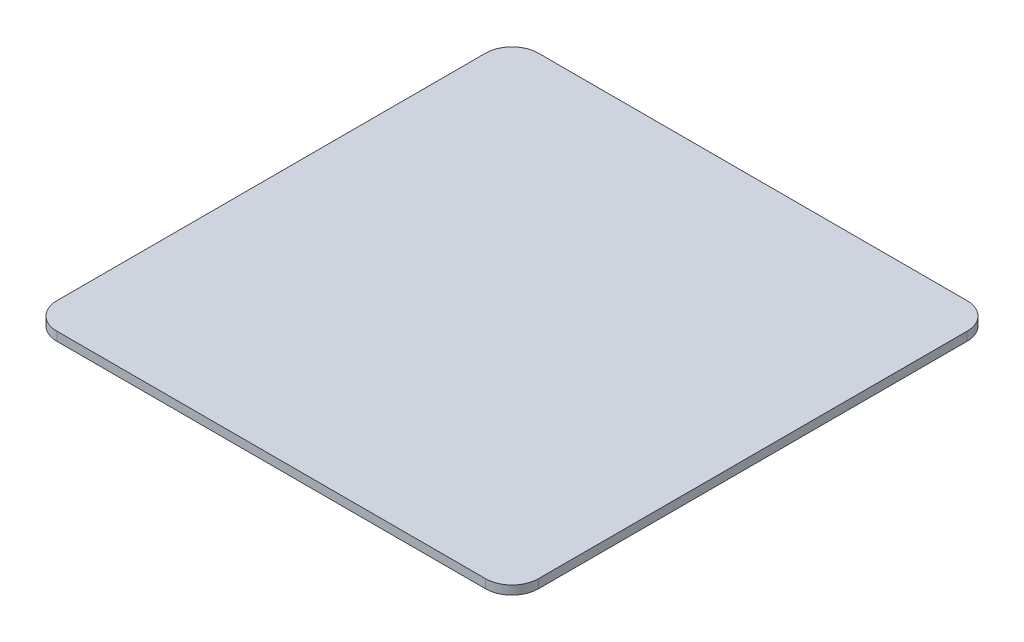
from build123d import *

# Parameters (mm, degrees)
SALIENTE_EXTRUIR1_DEPTH = 4


with BuildPart() as part:
    # Croquis1 → Saliente-Extruir1 (new, symmetric)
    with BuildSketch(Plane(origin=(0, 54.707138557, 0), x_dir=(1, 0, 0), z_dir=(0, 1, 0))):
        with BuildLine():
            Line((-178.357036721, -508.99553457), (117.897963279, -508.99553457))
            ThreePointArc((117.897963279, -508.99553457), (134.865368491, -501.967405212), (141.893497848, -485))
            Line((141.893497848, -485), (141.893497848, -95))
            ThreePointArc((141.893497848, -95), (134.865368491, -78.032594788), (117.897963279, -71.00446543))
            Line((117.897963279, -71.00446543), (24.152963279, -71.00446543))
            Line((24.152963279, -71.00446543), (-272.102036721, -71.00446543))
            ThreePointArc((-272.102036721, -71.00446543), (-289.069441934, -78.032594788), (-296.097571291, -95))
            Line((-296.097571291, -95), (-296.097571291, -485))
            ThreePointArc((-296.097571291, -485), (-289.069441934, -501.967405212), (-272.102036721, -508.99553457))
            Line((-272.102036721, -508.99553457), (-178.357036721, -508.99553457))
        make_face()
    extrude(amount=SALIENTE_EXTRUIR1_DEPTH, both=True)


solid = part.part
